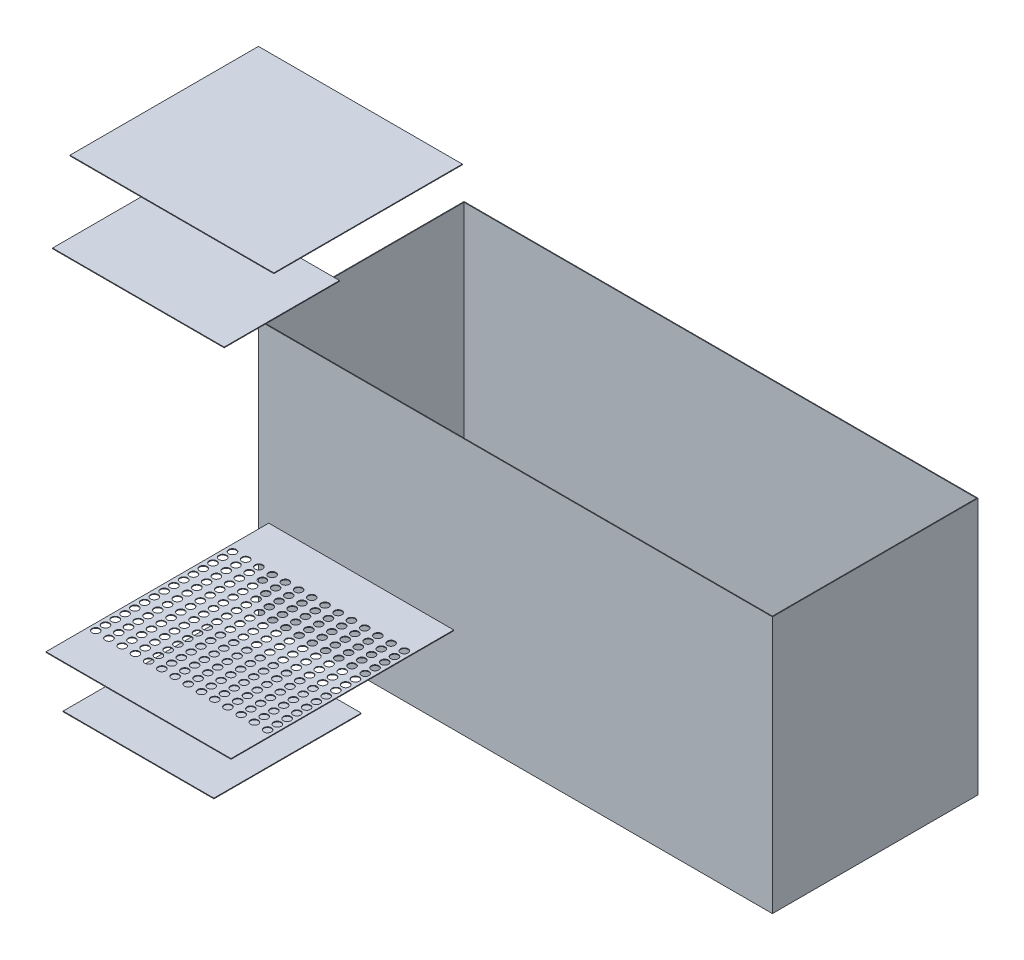
from build123d import *

# Parameters (mm, degrees)
MASTER_FOOTPRINT_W            = 1500
MASTER_FOOTPRINT_H            = 600
BATH_BASE_PLATE_DEPTH         = 750
BATH_SHELL_2MM_T              = -2
INLET_IMPACT_BAFFLE_START     = 125
SKETCH_1_W                    = 440
SKETCH_1_H                    = 430
INLET_IMPACT_BAFFLE_DEPTH     = 2
DISTRIBUTOR_D22_START         = 250
SKETCH_2_W                    = 540
SKETCH_2_H                    = 652
SKETCH_2_R                    = 11
DISTRIBUTOR_D22_DEPTH         = 2
OUTLET_SUBMERGED_BAFFLE_START = 1280
SKETCH_3_W                    = 500.714285714
SKETCH_3_H                    = 336.5
OUTLET_SUBMERGED_BAFFLE_DEPTH = 2
OVERFLOW_WEIR_Z550_START      = 1440
SKETCH_4_W                    = 595
SKETCH_4_H                    = 550
OVERFLOW_WEIR_Z550_DEPTH      = 2


with BuildPart() as part:
    # MASTER_FOOTPRINT → BATH_BASE_PLATE (new body)
    with BuildSketch(Plane(origin=(0, 0, 0), x_dir=(1, 0, 0), z_dir=(0, 1, 0))):
        with Locations((750, 300)):
            Rectangle(MASTER_FOOTPRINT_W, MASTER_FOOTPRINT_H)
    extrude(amount=BATH_BASE_PLATE_DEPTH)

    # BATH_SHELL_2MM
    bath_shell_2mm_openings = [part.faces().sort_by_distance(p)[0] for p in [
        (750, 750, -300),
    ]]
    offset(amount=BATH_SHELL_2MM_T, openings=bath_shell_2mm_openings, kind=Kind.INTERSECTION)


with BuildPart() as body_2:
    # Эскиз1 → INLET_IMPACT_BAFFLE (new body)
    with BuildSketch(Plane(origin=(0, 0, 0), x_dir=(1, 0, 0), z_dir=(0, 1, 0)).offset(INLET_IMPACT_BAFFLE_START)):
        with Locations((300, -435)):
            Rectangle(SKETCH_1_W, SKETCH_1_H)
    extrude(amount=INLET_IMPACT_BAFFLE_DEPTH)


with BuildPart() as body_3:
    # Эскиз2 → DISTRIBUTOR_D22 (new body)
    with BuildSketch(Plane(origin=(0, 0, 0), x_dir=(1, 0, 0), z_dir=(0, 1, 0)).offset(DISTRIBUTOR_D22_START)):
        with Locations((300, -324)):
            Rectangle(SKETCH_2_W, SKETCH_2_H)
        with Locations(Location((49.285714286, -125, 0), (0, 0, 270))):
            Circle(SKETCH_2_R, mode=Mode.SUBTRACT)
        with Locations(Location((49.285714286, -153.5, 0), (0, 0, 270))):
            Circle(SKETCH_2_R, mode=Mode.SUBTRACT)
        with Locations(Location((49.285714286, -182, 0), (0, 0, 270))):
            Circle(SKETCH_2_R, mode=Mode.SUBTRACT)
        with Locations(Location((49.285714286, -210.5, 0), (0, 0, 270))):
            Circle(SKETCH_2_R, mode=Mode.SUBTRACT)
        with Locations(Location((49.285714286, -239, 0), (0, 0, 270))):
            Circle(SKETCH_2_R, mode=Mode.SUBTRACT)
        with Locations(Location((49.285714286, -267.5, 0), (0, 0, 270))):
            Circle(SKETCH_2_R, mode=Mode.SUBTRACT)
        with Locations(Location((49.285714286, -296, 0), (0, 0, 270))):
            Circle(SKETCH_2_R, mode=Mode.SUBTRACT)
        with Locations(Location((49.285714286, -324.5, 0), (0, 0, 270))):
            Circle(SKETCH_2_R, mode=Mode.SUBTRACT)
        with Locations(Location((49.285714286, -353, 0), (0, 0, 270))):
            Circle(SKETCH_2_R, mode=Mode.SUBTRACT)
        with Locations(Location((49.285714286, -381.5, 0), (0, 0, 270))):
            Circle(SKETCH_2_R, mode=Mode.SUBTRACT)
        with Locations(Location((49.285714286, -410, 0), (0, 0, 270))):
            Circle(SKETCH_2_R, mode=Mode.SUBTRACT)
        with Locations(Location((49.285714286, -438.5, 0), (0, 0, 270))):
            Circle(SKETCH_2_R, mode=Mode.SUBTRACT)
        with Locations(Location((49.285714286, -467, 0), (0, 0, 270))):
            Circle(SKETCH_2_R, mode=Mode.SUBTRACT)
        with Locations(Location((49.285714286, -495.5, 0), (0, 0, 270))):
            Circle(SKETCH_2_R, mode=Mode.SUBTRACT)
        with Locations(Location((49.285714286, -524, 0), (0, 0, 270))):
            Circle(SKETCH_2_R, mode=Mode.SUBTRACT)
        with Locations(Location((87.857142857, -125, 0), (0, 0, 270))):
            Circle(SKETCH_2_R, mode=Mode.SUBTRACT)
        with Locations(Location((87.857142857, -153.5, 0), (0, 0, 270))):
            Circle(SKETCH_2_R, mode=Mode.SUBTRACT)
        with Locations(Location((87.857142857, -182, 0), (0, 0, 270))):
            Circle(SKETCH_2_R, mode=Mode.SUBTRACT)
        with Locations(Location((87.857142857, -210.5, 0), (0, 0, 270))):
            Circle(SKETCH_2_R, mode=Mode.SUBTRACT)
        with Locations(Location((87.857142857, -239, 0), (0, 0, 270))):
            Circle(SKETCH_2_R, mode=Mode.SUBTRACT)
        with Locations(Location((87.857142857, -267.5, 0), (0, 0, 270))):
            Circle(SKETCH_2_R, mode=Mode.SUBTRACT)
        with Locations(Location((87.857142857, -296, 0), (0, 0, 270))):
            Circle(SKETCH_2_R, mode=Mode.SUBTRACT)
        with Locations(Location((87.857142857, -324.5, 0), (0, 0, 270))):
            Circle(SKETCH_2_R, mode=Mode.SUBTRACT)
        with Locations(Location((87.857142857, -353, 0), (0, 0, 270))):
            Circle(SKETCH_2_R, mode=Mode.SUBTRACT)
        with Locations(Location((87.857142857, -381.5, 0), (0, 0, 270))):
            Circle(SKETCH_2_R, mode=Mode.SUBTRACT)
        with Locations(Location((87.857142857, -410, 0), (0, 0, 270))):
            Circle(SKETCH_2_R, mode=Mode.SUBTRACT)
        with Locations(Location((87.857142857, -438.5, 0), (0, 0, 270))):
            Circle(SKETCH_2_R, mode=Mode.SUBTRACT)
        with Locations(Location((87.857142857, -467, 0), (0, 0, 270))):
            Circle(SKETCH_2_R, mode=Mode.SUBTRACT)
        with Locations(Location((87.857142857, -495.5, 0), (0, 0, 270))):
            Circle(SKETCH_2_R, mode=Mode.SUBTRACT)
        with Locations(Location((87.857142857, -524, 0), (0, 0, 270))):
            Circle(SKETCH_2_R, mode=Mode.SUBTRACT)
        with Locations(Location((126.428571429, -125, 0), (0, 0, 270))):
            Circle(SKETCH_2_R, mode=Mode.SUBTRACT)
        with Locations(Location((126.428571429, -153.5, 0), (0, 0, 270))):
            Circle(SKETCH_2_R, mode=Mode.SUBTRACT)
        with Locations(Location((126.428571429, -182, 0), (0, 0, 270))):
            Circle(SKETCH_2_R, mode=Mode.SUBTRACT)
        with Locations(Location((126.428571429, -210.5, 0), (0, 0, 270))):
            Circle(SKETCH_2_R, mode=Mode.SUBTRACT)
        with Locations(Location((126.428571429, -239, 0), (0, 0, 270))):
            Circle(SKETCH_2_R, mode=Mode.SUBTRACT)
        with Locations(Location((126.428571429, -267.5, 0), (0, 0, 270))):
            Circle(SKETCH_2_R, mode=Mode.SUBTRACT)
        with Locations(Location((126.428571429, -296, 0), (0, 0, 270))):
            Circle(SKETCH_2_R, mode=Mode.SUBTRACT)
        with Locations(Location((126.428571429, -324.5, 0), (0, 0, 270))):
            Circle(SKETCH_2_R, mode=Mode.SUBTRACT)
        with Locations(Location((126.428571429, -353, 0), (0, 0, 270))):
            Circle(SKETCH_2_R, mode=Mode.SUBTRACT)
        with Locations(Location((126.428571429, -381.5, 0), (0, 0, 270))):
            Circle(SKETCH_2_R, mode=Mode.SUBTRACT)
        with Locations(Location((126.428571429, -410, 0), (0, 0, 270))):
            Circle(SKETCH_2_R, mode=Mode.SUBTRACT)
        with Locations(Location((126.428571429, -438.5, 0), (0, 0, 270))):
            Circle(SKETCH_2_R, mode=Mode.SUBTRACT)
        with Locations(Location((126.428571429, -467, 0), (0, 0, 270))):
            Circle(SKETCH_2_R, mode=Mode.SUBTRACT)
        with Locations(Location((126.428571429, -495.5, 0), (0, 0, 270))):
            Circle(SKETCH_2_R, mode=Mode.SUBTRACT)
        with Locations(Location((126.428571429, -524, 0), (0, 0, 270))):
            Circle(SKETCH_2_R, mode=Mode.SUBTRACT)
        with Locations(Location((165, -125, 0), (0, 0, 270))):
            Circle(SKETCH_2_R, mode=Mode.SUBTRACT)
        with Locations(Location((165, -153.5, 0), (0, 0, 270))):
            Circle(SKETCH_2_R, mode=Mode.SUBTRACT)
        with Locations(Location((165, -182, 0), (0, 0, 270))):
            Circle(SKETCH_2_R, mode=Mode.SUBTRACT)
        with Locations(Location((165, -210.5, 0), (0, 0, 270))):
            Circle(SKETCH_2_R, mode=Mode.SUBTRACT)
        with Locations(Location((165, -239, 0), (0, 0, 270))):
            Circle(SKETCH_2_R, mode=Mode.SUBTRACT)
        with Locations(Location((165, -267.5, 0), (0, 0, 270))):
            Circle(SKETCH_2_R, mode=Mode.SUBTRACT)
        with Locations(Location((165, -296, 0), (0, 0, 270))):
            Circle(SKETCH_2_R, mode=Mode.SUBTRACT)
        with Locations(Location((165, -324.5, 0), (0, 0, 270))):
            Circle(SKETCH_2_R, mode=Mode.SUBTRACT)
        with Locations(Location((165, -353, 0), (0, 0, 270))):
            Circle(SKETCH_2_R, mode=Mode.SUBTRACT)
        with Locations(Location((165, -381.5, 0), (0, 0, 270))):
            Circle(SKETCH_2_R, mode=Mode.SUBTRACT)
        with Locations(Location((165, -410, 0), (0, 0, 270))):
            Circle(SKETCH_2_R, mode=Mode.SUBTRACT)
        with Locations(Location((165, -438.5, 0), (0, 0, 270))):
            Circle(SKETCH_2_R, mode=Mode.SUBTRACT)
        with Locations(Location((165, -467, 0), (0, 0, 270))):
            Circle(SKETCH_2_R, mode=Mode.SUBTRACT)
        with Locations(Location((165, -495.5, 0), (0, 0, 270))):
            Circle(SKETCH_2_R, mode=Mode.SUBTRACT)
        with Locations(Location((165, -524, 0), (0, 0, 270))):
            Circle(SKETCH_2_R, mode=Mode.SUBTRACT)
        with Locations(Location((203.571428571, -125, 0), (0, 0, 270))):
            Circle(SKETCH_2_R, mode=Mode.SUBTRACT)
        with Locations(Location((203.571428571, -153.5, 0), (0, 0, 270))):
            Circle(SKETCH_2_R, mode=Mode.SUBTRACT)
        with Locations(Location((203.571428571, -182, 0), (0, 0, 270))):
            Circle(SKETCH_2_R, mode=Mode.SUBTRACT)
        with Locations(Location((203.571428571, -210.5, 0), (0, 0, 270))):
            Circle(SKETCH_2_R, mode=Mode.SUBTRACT)
        with Locations(Location((203.571428571, -239, 0), (0, 0, 270))):
            Circle(SKETCH_2_R, mode=Mode.SUBTRACT)
        with Locations(Location((203.571428571, -267.5, 0), (0, 0, 270))):
            Circle(SKETCH_2_R, mode=Mode.SUBTRACT)
        with Locations(Location((203.571428571, -296, 0), (0, 0, 270))):
            Circle(SKETCH_2_R, mode=Mode.SUBTRACT)
        with Locations(Location((203.571428571, -324.5, 0), (0, 0, 270))):
            Circle(SKETCH_2_R, mode=Mode.SUBTRACT)
        with Locations(Location((203.571428571, -353, 0), (0, 0, 270))):
            Circle(SKETCH_2_R, mode=Mode.SUBTRACT)
        with Locations(Location((203.571428571, -381.5, 0), (0, 0, 270))):
            Circle(SKETCH_2_R, mode=Mode.SUBTRACT)
        with Locations(Location((203.571428571, -410, 0), (0, 0, 270))):
            Circle(SKETCH_2_R, mode=Mode.SUBTRACT)
        with Locations(Location((203.571428571, -438.5, 0), (0, 0, 270))):
            Circle(SKETCH_2_R, mode=Mode.SUBTRACT)
        with Locations(Location((203.571428571, -467, 0), (0, 0, 270))):
            Circle(SKETCH_2_R, mode=Mode.SUBTRACT)
        with Locations(Location((203.571428571, -495.5, 0), (0, 0, 270))):
            Circle(SKETCH_2_R, mode=Mode.SUBTRACT)
        with Locations(Location((203.571428571, -524, 0), (0, 0, 270))):
            Circle(SKETCH_2_R, mode=Mode.SUBTRACT)
        with Locations(Location((242.142857143, -125, 0), (0, 0, 270))):
            Circle(SKETCH_2_R, mode=Mode.SUBTRACT)
        with Locations(Location((242.142857143, -153.5, 0), (0, 0, 270))):
            Circle(SKETCH_2_R, mode=Mode.SUBTRACT)
        with Locations(Location((242.142857143, -182, 0), (0, 0, 270))):
            Circle(SKETCH_2_R, mode=Mode.SUBTRACT)
        with Locations(Location((242.142857143, -210.5, 0), (0, 0, 270))):
            Circle(SKETCH_2_R, mode=Mode.SUBTRACT)
        with Locations(Location((242.142857143, -239, 0), (0, 0, 270))):
            Circle(SKETCH_2_R, mode=Mode.SUBTRACT)
        with Locations(Location((242.142857143, -267.5, 0), (0, 0, 270))):
            Circle(SKETCH_2_R, mode=Mode.SUBTRACT)
        with Locations(Location((242.142857143, -296, 0), (0, 0, 270))):
            Circle(SKETCH_2_R, mode=Mode.SUBTRACT)
        with Locations(Location((242.142857143, -324.5, 0), (0, 0, 270))):
            Circle(SKETCH_2_R, mode=Mode.SUBTRACT)
        with Locations(Location((242.142857143, -353, 0), (0, 0, 270))):
            Circle(SKETCH_2_R, mode=Mode.SUBTRACT)
        with Locations(Location((242.142857143, -381.5, 0), (0, 0, 270))):
            Circle(SKETCH_2_R, mode=Mode.SUBTRACT)
        with Locations(Location((242.142857143, -410, 0), (0, 0, 270))):
            Circle(SKETCH_2_R, mode=Mode.SUBTRACT)
        with Locations(Location((242.142857143, -438.5, 0), (0, 0, 270))):
            Circle(SKETCH_2_R, mode=Mode.SUBTRACT)
        with Locations(Location((242.142857143, -467, 0), (0, 0, 270))):
            Circle(SKETCH_2_R, mode=Mode.SUBTRACT)
        with Locations(Location((242.142857143, -495.5, 0), (0, 0, 270))):
            Circle(SKETCH_2_R, mode=Mode.SUBTRACT)
        with Locations(Location((242.142857143, -524, 0), (0, 0, 270))):
            Circle(SKETCH_2_R, mode=Mode.SUBTRACT)
        with Locations(Location((280.714285714, -125, 0), (0, 0, 270))):
            Circle(SKETCH_2_R, mode=Mode.SUBTRACT)
        with Locations(Location((280.714285714, -153.5, 0), (0, 0, 270))):
            Circle(SKETCH_2_R, mode=Mode.SUBTRACT)
        with Locations(Location((280.714285714, -182, 0), (0, 0, 270))):
            Circle(SKETCH_2_R, mode=Mode.SUBTRACT)
        with Locations(Location((280.714285714, -210.5, 0), (0, 0, 270))):
            Circle(SKETCH_2_R, mode=Mode.SUBTRACT)
        with Locations(Location((280.714285714, -239, 0), (0, 0, 270))):
            Circle(SKETCH_2_R, mode=Mode.SUBTRACT)
        with Locations(Location((280.714285714, -267.5, 0), (0, 0, 270))):
            Circle(SKETCH_2_R, mode=Mode.SUBTRACT)
        with Locations(Location((280.714285714, -296, 0), (0, 0, 270))):
            Circle(SKETCH_2_R, mode=Mode.SUBTRACT)
        with Locations(Location((280.714285714, -324.5, 0), (0, 0, 270))):
            Circle(SKETCH_2_R, mode=Mode.SUBTRACT)
        with Locations(Location((280.714285714, -353, 0), (0, 0, 270))):
            Circle(SKETCH_2_R, mode=Mode.SUBTRACT)
        with Locations(Location((280.714285714, -381.5, 0), (0, 0, 270))):
            Circle(SKETCH_2_R, mode=Mode.SUBTRACT)
        with Locations(Location((280.714285714, -410, 0), (0, 0, 270))):
            Circle(SKETCH_2_R, mode=Mode.SUBTRACT)
        with Locations(Location((280.714285714, -438.5, 0), (0, 0, 270))):
            Circle(SKETCH_2_R, mode=Mode.SUBTRACT)
        with Locations(Location((280.714285714, -467, 0), (0, 0, 270))):
            Circle(SKETCH_2_R, mode=Mode.SUBTRACT)
        with Locations(Location((280.714285714, -495.5, 0), (0, 0, 270))):
            Circle(SKETCH_2_R, mode=Mode.SUBTRACT)
        with Locations(Location((280.714285714, -524, 0), (0, 0, 270))):
            Circle(SKETCH_2_R, mode=Mode.SUBTRACT)
        with Locations(Location((319.285714286, -125, 0), (0, 0, 270))):
            Circle(SKETCH_2_R, mode=Mode.SUBTRACT)
        with Locations(Location((319.285714286, -153.5, 0), (0, 0, 270))):
            Circle(SKETCH_2_R, mode=Mode.SUBTRACT)
        with Locations(Location((319.285714286, -182, 0), (0, 0, 270))):
            Circle(SKETCH_2_R, mode=Mode.SUBTRACT)
        with Locations(Location((319.285714286, -210.5, 0), (0, 0, 270))):
            Circle(SKETCH_2_R, mode=Mode.SUBTRACT)
        with Locations(Location((319.285714286, -239, 0), (0, 0, 270))):
            Circle(SKETCH_2_R, mode=Mode.SUBTRACT)
        with Locations(Location((319.285714286, -267.5, 0), (0, 0, 270))):
            Circle(SKETCH_2_R, mode=Mode.SUBTRACT)
        with Locations(Location((319.285714286, -296, 0), (0, 0, 270))):
            Circle(SKETCH_2_R, mode=Mode.SUBTRACT)
        with Locations(Location((319.285714286, -324.5, 0), (0, 0, 270))):
            Circle(SKETCH_2_R, mode=Mode.SUBTRACT)
        with Locations(Location((319.285714286, -353, 0), (0, 0, 270))):
            Circle(SKETCH_2_R, mode=Mode.SUBTRACT)
        with Locations(Location((319.285714286, -381.5, 0), (0, 0, 270))):
            Circle(SKETCH_2_R, mode=Mode.SUBTRACT)
        with Locations(Location((319.285714286, -410, 0), (0, 0, 270))):
            Circle(SKETCH_2_R, mode=Mode.SUBTRACT)
        with Locations(Location((319.285714286, -438.5, 0), (0, 0, 270))):
            Circle(SKETCH_2_R, mode=Mode.SUBTRACT)
        with Locations(Location((319.285714286, -467, 0), (0, 0, 270))):
            Circle(SKETCH_2_R, mode=Mode.SUBTRACT)
        with Locations(Location((319.285714286, -495.5, 0), (0, 0, 270))):
            Circle(SKETCH_2_R, mode=Mode.SUBTRACT)
        with Locations(Location((319.285714286, -524, 0), (0, 0, 270))):
            Circle(SKETCH_2_R, mode=Mode.SUBTRACT)
        with Locations(Location((357.857142857, -125, 0), (0, 0, 270))):
            Circle(SKETCH_2_R, mode=Mode.SUBTRACT)
        with Locations(Location((357.857142857, -153.5, 0), (0, 0, 270))):
            Circle(SKETCH_2_R, mode=Mode.SUBTRACT)
        with Locations(Location((357.857142857, -182, 0), (0, 0, 270))):
            Circle(SKETCH_2_R, mode=Mode.SUBTRACT)
        with Locations(Location((357.857142857, -210.5, 0), (0, 0, 270))):
            Circle(SKETCH_2_R, mode=Mode.SUBTRACT)
        with Locations(Location((357.857142857, -239, 0), (0, 0, 270))):
            Circle(SKETCH_2_R, mode=Mode.SUBTRACT)
        with Locations(Location((357.857142857, -267.5, 0), (0, 0, 270))):
            Circle(SKETCH_2_R, mode=Mode.SUBTRACT)
        with Locations(Location((357.857142857, -296, 0), (0, 0, 270))):
            Circle(SKETCH_2_R, mode=Mode.SUBTRACT)
        with Locations(Location((357.857142857, -324.5, 0), (0, 0, 270))):
            Circle(SKETCH_2_R, mode=Mode.SUBTRACT)
        with Locations(Location((357.857142857, -353, 0), (0, 0, 270))):
            Circle(SKETCH_2_R, mode=Mode.SUBTRACT)
        with Locations(Location((357.857142857, -381.5, 0), (0, 0, 270))):
            Circle(SKETCH_2_R, mode=Mode.SUBTRACT)
        with Locations(Location((357.857142857, -410, 0), (0, 0, 270))):
            Circle(SKETCH_2_R, mode=Mode.SUBTRACT)
        with Locations(Location((357.857142857, -438.5, 0), (0, 0, 270))):
            Circle(SKETCH_2_R, mode=Mode.SUBTRACT)
        with Locations(Location((357.857142857, -467, 0), (0, 0, 270))):
            Circle(SKETCH_2_R, mode=Mode.SUBTRACT)
        with Locations(Location((357.857142857, -495.5, 0), (0, 0, 270))):
            Circle(SKETCH_2_R, mode=Mode.SUBTRACT)
        with Locations(Location((357.857142857, -524, 0), (0, 0, 270))):
            Circle(SKETCH_2_R, mode=Mode.SUBTRACT)
        with Locations(Location((396.428571429, -125, 0), (0, 0, 270))):
            Circle(SKETCH_2_R, mode=Mode.SUBTRACT)
        with Locations(Location((396.428571429, -153.5, 0), (0, 0, 270))):
            Circle(SKETCH_2_R, mode=Mode.SUBTRACT)
        with Locations(Location((396.428571429, -182, 0), (0, 0, 270))):
            Circle(SKETCH_2_R, mode=Mode.SUBTRACT)
        with Locations(Location((396.428571429, -210.5, 0), (0, 0, 270))):
            Circle(SKETCH_2_R, mode=Mode.SUBTRACT)
        with Locations(Location((396.428571429, -239, 0), (0, 0, 270))):
            Circle(SKETCH_2_R, mode=Mode.SUBTRACT)
        with Locations(Location((396.428571429, -267.5, 0), (0, 0, 270))):
            Circle(SKETCH_2_R, mode=Mode.SUBTRACT)
        with Locations(Location((396.428571429, -296, 0), (0, 0, 270))):
            Circle(SKETCH_2_R, mode=Mode.SUBTRACT)
        with Locations(Location((396.428571429, -324.5, 0), (0, 0, 270))):
            Circle(SKETCH_2_R, mode=Mode.SUBTRACT)
        with Locations(Location((396.428571429, -353, 0), (0, 0, 270))):
            Circle(SKETCH_2_R, mode=Mode.SUBTRACT)
        with Locations(Location((396.428571429, -381.5, 0), (0, 0, 270))):
            Circle(SKETCH_2_R, mode=Mode.SUBTRACT)
        with Locations(Location((396.428571429, -410, 0), (0, 0, 270))):
            Circle(SKETCH_2_R, mode=Mode.SUBTRACT)
        with Locations(Location((396.428571429, -438.5, 0), (0, 0, 270))):
            Circle(SKETCH_2_R, mode=Mode.SUBTRACT)
        with Locations(Location((396.428571429, -467, 0), (0, 0, 270))):
            Circle(SKETCH_2_R, mode=Mode.SUBTRACT)
        with Locations(Location((396.428571429, -495.5, 0), (0, 0, 270))):
            Circle(SKETCH_2_R, mode=Mode.SUBTRACT)
        with Locations(Location((396.428571429, -524, 0), (0, 0, 270))):
            Circle(SKETCH_2_R, mode=Mode.SUBTRACT)
        with Locations(Location((435, -125, 0), (0, 0, 270))):
            Circle(SKETCH_2_R, mode=Mode.SUBTRACT)
        with Locations(Location((435, -153.5, 0), (0, 0, 270))):
            Circle(SKETCH_2_R, mode=Mode.SUBTRACT)
        with Locations(Location((435, -182, 0), (0, 0, 270))):
            Circle(SKETCH_2_R, mode=Mode.SUBTRACT)
        with Locations(Location((435, -210.5, 0), (0, 0, 270))):
            Circle(SKETCH_2_R, mode=Mode.SUBTRACT)
        with Locations(Location((435, -239, 0), (0, 0, 270))):
            Circle(SKETCH_2_R, mode=Mode.SUBTRACT)
        with Locations(Location((435, -267.5, 0), (0, 0, 270))):
            Circle(SKETCH_2_R, mode=Mode.SUBTRACT)
        with Locations(Location((435, -296, 0), (0, 0, 270))):
            Circle(SKETCH_2_R, mode=Mode.SUBTRACT)
        with Locations(Location((435, -324.5, 0), (0, 0, 270))):
            Circle(SKETCH_2_R, mode=Mode.SUBTRACT)
        with Locations(Location((435, -353, 0), (0, 0, 270))):
            Circle(SKETCH_2_R, mode=Mode.SUBTRACT)
        with Locations(Location((435, -381.5, 0), (0, 0, 270))):
            Circle(SKETCH_2_R, mode=Mode.SUBTRACT)
        with Locations(Location((435, -410, 0), (0, 0, 270))):
            Circle(SKETCH_2_R, mode=Mode.SUBTRACT)
        with Locations(Location((435, -438.5, 0), (0, 0, 270))):
            Circle(SKETCH_2_R, mode=Mode.SUBTRACT)
        with Locations(Location((435, -467, 0), (0, 0, 270))):
            Circle(SKETCH_2_R, mode=Mode.SUBTRACT)
        with Locations(Location((435, -495.5, 0), (0, 0, 270))):
            Circle(SKETCH_2_R, mode=Mode.SUBTRACT)
        with Locations(Location((435, -524, 0), (0, 0, 270))):
            Circle(SKETCH_2_R, mode=Mode.SUBTRACT)
        with Locations(Location((473.571428571, -125, 0), (0, 0, 270))):
            Circle(SKETCH_2_R, mode=Mode.SUBTRACT)
        with Locations(Location((473.571428571, -153.5, 0), (0, 0, 270))):
            Circle(SKETCH_2_R, mode=Mode.SUBTRACT)
        with Locations(Location((473.571428571, -182, 0), (0, 0, 270))):
            Circle(SKETCH_2_R, mode=Mode.SUBTRACT)
        with Locations(Location((473.571428571, -210.5, 0), (0, 0, 270))):
            Circle(SKETCH_2_R, mode=Mode.SUBTRACT)
        with Locations(Location((473.571428571, -239, 0), (0, 0, 270))):
            Circle(SKETCH_2_R, mode=Mode.SUBTRACT)
        with Locations(Location((473.571428571, -267.5, 0), (0, 0, 270))):
            Circle(SKETCH_2_R, mode=Mode.SUBTRACT)
        with Locations(Location((473.571428571, -296, 0), (0, 0, 270))):
            Circle(SKETCH_2_R, mode=Mode.SUBTRACT)
        with Locations(Location((473.571428571, -324.5, 0), (0, 0, 270))):
            Circle(SKETCH_2_R, mode=Mode.SUBTRACT)
        with Locations(Location((473.571428571, -353, 0), (0, 0, 270))):
            Circle(SKETCH_2_R, mode=Mode.SUBTRACT)
        with Locations(Location((473.571428571, -381.5, 0), (0, 0, 270))):
            Circle(SKETCH_2_R, mode=Mode.SUBTRACT)
        with Locations(Location((473.571428571, -410, 0), (0, 0, 270))):
            Circle(SKETCH_2_R, mode=Mode.SUBTRACT)
        with Locations(Location((473.571428571, -438.5, 0), (0, 0, 270))):
            Circle(SKETCH_2_R, mode=Mode.SUBTRACT)
        with Locations(Location((473.571428571, -467, 0), (0, 0, 270))):
            Circle(SKETCH_2_R, mode=Mode.SUBTRACT)
        with Locations(Location((473.571428571, -495.5, 0), (0, 0, 270))):
            Circle(SKETCH_2_R, mode=Mode.SUBTRACT)
        with Locations(Location((473.571428571, -524, 0), (0, 0, 270))):
            Circle(SKETCH_2_R, mode=Mode.SUBTRACT)
        with Locations(Location((512.142857143, -125, 0), (0, 0, 270))):
            Circle(SKETCH_2_R, mode=Mode.SUBTRACT)
        with Locations(Location((512.142857143, -153.5, 0), (0, 0, 270))):
            Circle(SKETCH_2_R, mode=Mode.SUBTRACT)
        with Locations(Location((512.142857143, -182, 0), (0, 0, 270))):
            Circle(SKETCH_2_R, mode=Mode.SUBTRACT)
        with Locations(Location((512.142857143, -210.5, 0), (0, 0, 270))):
            Circle(SKETCH_2_R, mode=Mode.SUBTRACT)
        with Locations(Location((512.142857143, -239, 0), (0, 0, 270))):
            Circle(SKETCH_2_R, mode=Mode.SUBTRACT)
        with Locations(Location((512.142857143, -267.5, 0), (0, 0, 270))):
            Circle(SKETCH_2_R, mode=Mode.SUBTRACT)
        with Locations(Location((512.142857143, -296, 0), (0, 0, 270))):
            Circle(SKETCH_2_R, mode=Mode.SUBTRACT)
        with Locations(Location((512.142857143, -324.5, 0), (0, 0, 270))):
            Circle(SKETCH_2_R, mode=Mode.SUBTRACT)
        with Locations(Location((512.142857143, -353, 0), (0, 0, 270))):
            Circle(SKETCH_2_R, mode=Mode.SUBTRACT)
        with Locations(Location((512.142857143, -381.5, 0), (0, 0, 270))):
            Circle(SKETCH_2_R, mode=Mode.SUBTRACT)
        with Locations(Location((512.142857143, -410, 0), (0, 0, 270))):
            Circle(SKETCH_2_R, mode=Mode.SUBTRACT)
        with Locations(Location((512.142857143, -438.5, 0), (0, 0, 270))):
            Circle(SKETCH_2_R, mode=Mode.SUBTRACT)
        with Locations(Location((512.142857143, -467, 0), (0, 0, 270))):
            Circle(SKETCH_2_R, mode=Mode.SUBTRACT)
        with Locations(Location((512.142857143, -495.5, 0), (0, 0, 270))):
            Circle(SKETCH_2_R, mode=Mode.SUBTRACT)
        with Locations(Location((512.142857143, -524, 0), (0, 0, 270))):
            Circle(SKETCH_2_R, mode=Mode.SUBTRACT)
        with Locations(Location((550.714285714, -125, 0), (0, 0, 270))):
            Circle(SKETCH_2_R, mode=Mode.SUBTRACT)
        with Locations(Location((550.714285714, -153.5, 0), (0, 0, 270))):
            Circle(SKETCH_2_R, mode=Mode.SUBTRACT)
        with Locations(Location((550.714285714, -182, 0), (0, 0, 270))):
            Circle(SKETCH_2_R, mode=Mode.SUBTRACT)
        with Locations(Location((550.714285714, -210.5, 0), (0, 0, 270))):
            Circle(SKETCH_2_R, mode=Mode.SUBTRACT)
        with Locations(Location((550.714285714, -239, 0), (0, 0, 270))):
            Circle(SKETCH_2_R, mode=Mode.SUBTRACT)
        with Locations(Location((550.714285714, -267.5, 0), (0, 0, 270))):
            Circle(SKETCH_2_R, mode=Mode.SUBTRACT)
        with Locations(Location((550.714285714, -296, 0), (0, 0, 270))):
            Circle(SKETCH_2_R, mode=Mode.SUBTRACT)
        with Locations(Location((550.714285714, -324.5, 0), (0, 0, 270))):
            Circle(SKETCH_2_R, mode=Mode.SUBTRACT)
        with Locations(Location((550.714285714, -353, 0), (0, 0, 270))):
            Circle(SKETCH_2_R, mode=Mode.SUBTRACT)
        with Locations(Location((550.714285714, -381.5, 0), (0, 0, 270))):
            Circle(SKETCH_2_R, mode=Mode.SUBTRACT)
        with Locations(Location((550.714285714, -410, 0), (0, 0, 270))):
            Circle(SKETCH_2_R, mode=Mode.SUBTRACT)
        with Locations(Location((550.714285714, -438.5, 0), (0, 0, 270))):
            Circle(SKETCH_2_R, mode=Mode.SUBTRACT)
        with Locations(Location((550.714285714, -467, 0), (0, 0, 270))):
            Circle(SKETCH_2_R, mode=Mode.SUBTRACT)
        with Locations(Location((550.714285714, -495.5, 0), (0, 0, 270))):
            Circle(SKETCH_2_R, mode=Mode.SUBTRACT)
        with Locations(Location((550.714285714, -524, 0), (0, 0, 270))):
            Circle(SKETCH_2_R, mode=Mode.SUBTRACT)
    extrude(amount=DISTRIBUTOR_D22_DEPTH)


with BuildPart() as body_4:
    # Эскиз3 → OUTLET_SUBMERGED_BAFFLE (new body)
    with BuildSketch(Plane(origin=(0, 0, 0), x_dir=(1, 0, 0), z_dir=(0, 1, 0)).offset(OUTLET_SUBMERGED_BAFFLE_START)):
        with Locations((299.642857143, -481.75)):
            Rectangle(SKETCH_3_W, SKETCH_3_H)
    extrude(amount=OUTLET_SUBMERGED_BAFFLE_DEPTH)


with BuildPart() as body_5:
    # Эскиз4 → OVERFLOW_WEIR_Z550 (new body)
    with BuildSketch(Plane(origin=(0, 0, 0), x_dir=(1, 0, 0), z_dir=(0, 1, 0)).offset(OVERFLOW_WEIR_Z550_START)):
        with Locations((297.5, -275)):
            Rectangle(SKETCH_4_W, SKETCH_4_H)
    extrude(amount=OVERFLOW_WEIR_Z550_DEPTH)


solid = Compound([part.part, body_2.part, body_3.part, body_4.part, body_5.part])
